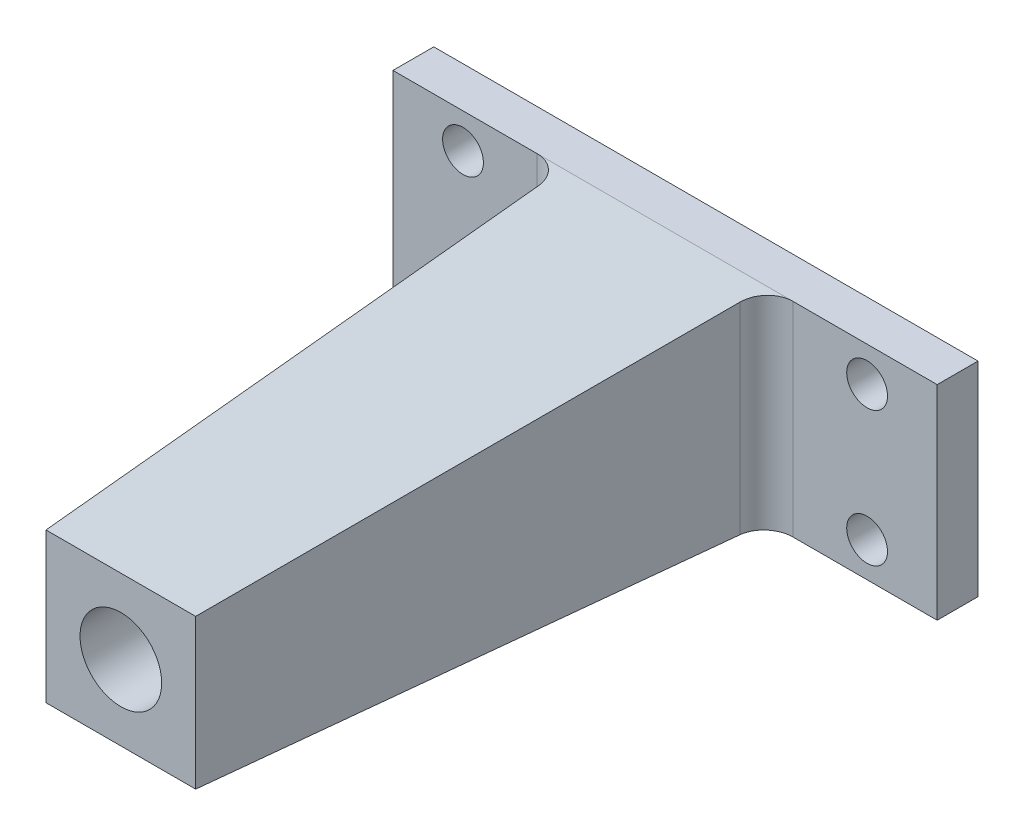
from build123d import *

# Parameters (mm, degrees)
SKETCH_1_W          = 40
SKETCH_1_H          = 15
SKETCH_1_R          = 1.5
EXTRUDE_1_DEPTH     = 3
SKETCH_5_R          = 1.5
CUT_EXTRUDE_3_DEPTH = 8
SKETCH_8_R          = 2.999642866
CUT_EXTRUDE_4_DEPTH = 15
SKETCH_9_R          = 1.5
CUT_EXTRUDE_5_DEPTH = 15
FILLET_1_R          = 2


with BuildPart() as part:
    # 草图1 → 凸台-拉伸1 (new body)
    with BuildSketch(Plane.XY):
        Rectangle(SKETCH_1_W, SKETCH_1_H)
        with Locations((4.95, 4.95)):
            Circle(SKETCH_1_R, mode=Mode.SUBTRACT)
        with Locations((4.95, -4.95)):
            Circle(SKETCH_1_R, mode=Mode.SUBTRACT)
        with Locations((-4.95, -4.95)):
            Circle(SKETCH_1_R, mode=Mode.SUBTRACT)
        with Locations((-4.95, 4.95)):
            Circle(SKETCH_1_R, mode=Mode.SUBTRACT)
    extrude(amount=EXTRUDE_1_DEPTH)

    # 草图3 → 放样1 section 0
    with BuildSketch(Plane.XY.offset(43)):
        with BuildLine():
            Line((-5.5, -5.5), (5.5, -5.5))
            Line((5.5, -5.5), (5.5, 5.5))
            Line((5.5, 5.5), (-5.5, 5.5))
            Line((-5.5, 5.5), (-5.5, -5.5))
        make_face()
    # 草图2 → 放样1 section 1
    with BuildSketch(Plane.XY.offset(3)):
        with BuildLine():
            Line((-7.5, -7.5), (7.5, -7.5))
            Line((7.5, -7.5), (7.5, 7.5))
            Line((7.5, 7.5), (-7.5, 7.5))
            Line((-7.5, 7.5), (-7.5, -7.5))
        make_face()
    loft()

    # 草图5 → 切除-拉伸3 (cut)
    with BuildSketch(Plane(origin=(0, 0, 0), x_dir=(-1, 0, 0), z_dir=(0, 0, -1))):
        with Locations((4.95, -4.95)):
            Circle(SKETCH_5_R)
        with Locations((4.95, 4.95)):
            Circle(SKETCH_5_R)
        with Locations((-4.95, 4.95)):
            Circle(SKETCH_5_R)
        with Locations((-4.95, -4.95)):
            Circle(SKETCH_5_R)
    extrude(amount=-CUT_EXTRUDE_3_DEPTH, mode=Mode.SUBTRACT)

    # 草图8 → 切除-拉伸4 (cut)
    with BuildSketch(Plane.XY.offset(43)):
        Circle(SKETCH_8_R)
    extrude(amount=-CUT_EXTRUDE_4_DEPTH, mode=Mode.SUBTRACT)

    # 草图9 → 切除-拉伸5 (cut)
    with BuildSketch(Plane(origin=(0, 0, 0), x_dir=(-1, 0, 0), z_dir=(0, 0, -1))):
        with Locations((-14.848989873, -4.95)):
            Circle(SKETCH_9_R)
        with Locations((-14.848989873, 4.949494936)):
            Circle(SKETCH_9_R)
        with Locations((14.849494937, 4.949494936)):
            Circle(SKETCH_9_R)
        with Locations((14.849494937, -4.95)):
            Circle(SKETCH_9_R)
    extrude(amount=-CUT_EXTRUDE_5_DEPTH, mode=Mode.SUBTRACT)

    # 圆角1
    fillet_1_edges = [part.edges().sort_by_distance(p)[0] for p in [
        (7.5, 0, 3),
        (-7.5, 0, 3),
    ]]
    fillet(fillet_1_edges, radius=FILLET_1_R)


solid = part.part
